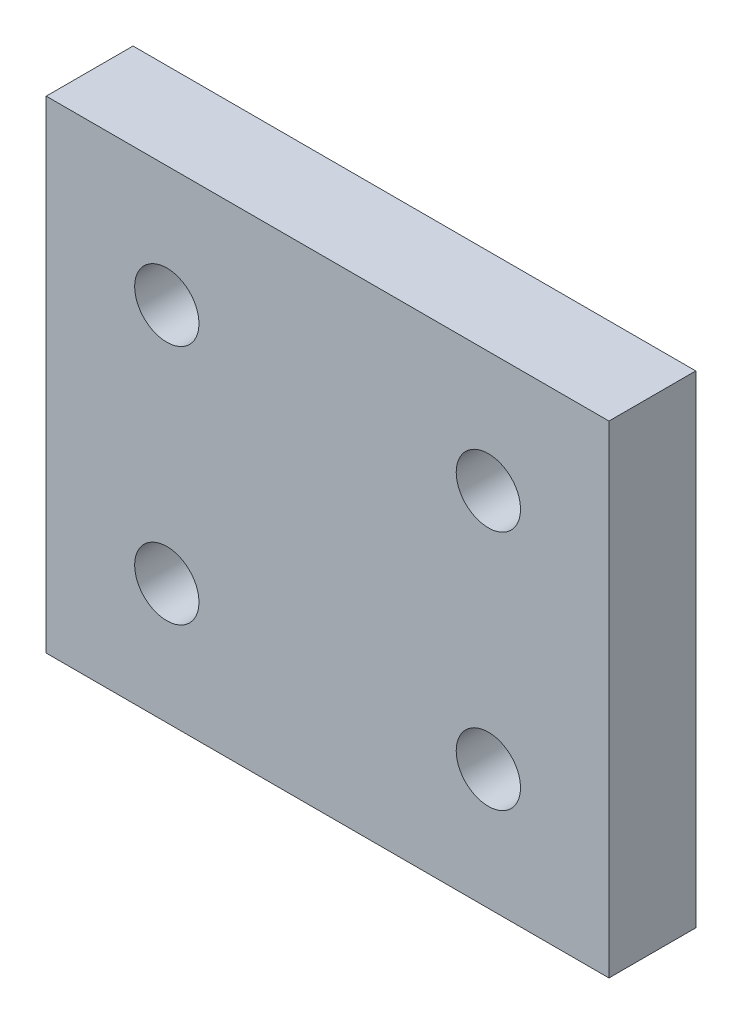
from build123d import *

# Parameters (mm, degrees)
SKETCH1_W                      = 35
SKETCH1_H                      = 60
BOSS_EXTRUDE1_DEPTH            = 5.4
CUT_EXTRUDE1_REACH             = 37.148
SKETCH2_W                      = 35
SKETCH2_H                      = 2.655
SKETCH2_R                      = 2
SKETCH2_H_2                    = 17.637243623
SKETCH2_H_3                    = 9.707756377
CUT_EXTRUDE1_DIRECTION_2_DEPTH = 36.148399679


with BuildPart() as part:
    # Sketch1 → Boss-Extrude1 (new body)
    with BuildSketch(Plane.XY):
        Rectangle(SKETCH1_W, SKETCH1_H)
    extrude(amount=BOSS_EXTRUDE1_DEPTH)

    # Sketch2 → Cut-Extrude1 (cut, up to next)
    with BuildSketch(Plane.XY.offset(5.4), mode=Mode.PRIVATE) as cut_extrude1_sk1:
        with Locations((0, 28.6725)):
            Rectangle(SKETCH2_W, SKETCH2_H)
    cut_extrude1_tool1 = extrude(cut_extrude1_sk1.sketch, amount=-CUT_EXTRUDE1_REACH, mode=Mode.PRIVATE) & part.part
    # Sketch2 → Cut-Extrude1 (cut, up to next)
    with BuildSketch(Plane.XY.offset(5.4), mode=Mode.PRIVATE) as cut_extrude1_sk2:
        with Locations(Location((-10, 19.84, 0), (0, 0, 180))):
            Circle(SKETCH2_R)
    cut_extrude1_tool2 = extrude(cut_extrude1_sk2.sketch, amount=-CUT_EXTRUDE1_REACH, mode=Mode.PRIVATE) & part.part
    # Sketch2 → Cut-Extrude1 (cut, up to next)
    with BuildSketch(Plane.XY.offset(5.4), mode=Mode.PRIVATE) as cut_extrude1_sk3:
        with Locations(Location((10, 19.84, 0), (0, 0, 180))):
            Circle(SKETCH2_R)
    cut_extrude1_tool3 = extrude(cut_extrude1_sk3.sketch, amount=-CUT_EXTRUDE1_REACH, mode=Mode.PRIVATE) & part.part
    # Sketch2 → Cut-Extrude1 (cut, up to next)
    with BuildSketch(Plane.XY.offset(5.4), mode=Mode.PRIVATE) as cut_extrude1_sk4:
        with Locations(Location((-10, 4.84, 0), (0, 0, 180))):
            Circle(SKETCH2_R)
    cut_extrude1_tool4 = extrude(cut_extrude1_sk4.sketch, amount=-CUT_EXTRUDE1_REACH, mode=Mode.PRIVATE) & part.part
    # Sketch2 → Cut-Extrude1 (cut, up to next)
    with BuildSketch(Plane.XY.offset(5.4), mode=Mode.PRIVATE) as cut_extrude1_sk5:
        with Locations(Location((10, 4.84, 0), (0, 0, 180))):
            Circle(SKETCH2_R)
    cut_extrude1_tool5 = extrude(cut_extrude1_sk5.sketch, amount=-CUT_EXTRUDE1_REACH, mode=Mode.PRIVATE) & part.part
    # Sketch2 → Cut-Extrude1 (cut, up to next)
    with BuildSketch(Plane.XY.offset(5.4), mode=Mode.PRIVATE) as cut_extrude1_sk6:
        with Locations((0, -11.473621812)):
            Rectangle(SKETCH2_W, SKETCH2_H_2)
    cut_extrude1_tool6 = extrude(cut_extrude1_sk6.sketch, amount=-CUT_EXTRUDE1_REACH, mode=Mode.PRIVATE) & part.part
    # Sketch2 → Cut-Extrude1 (cut, up to next)
    with BuildSketch(Plane.XY.offset(5.4), mode=Mode.PRIVATE) as cut_extrude1_sk7:
        with Locations((0, -25.146121812)):
            Rectangle(SKETCH2_W, SKETCH2_H_3)
    cut_extrude1_tool7 = extrude(cut_extrude1_sk7.sketch, amount=-CUT_EXTRUDE1_REACH, mode=Mode.PRIVATE) & part.part
    add(cut_extrude1_tool1.solids().sort_by_distance((0, 28.6725, 5.4))[0], mode=Mode.SUBTRACT)
    add(cut_extrude1_tool2.solids().sort_by_distance((-10, 19.84, 5.4))[0], mode=Mode.SUBTRACT)
    add(cut_extrude1_tool3.solids().sort_by_distance((10, 19.84, 5.4))[0], mode=Mode.SUBTRACT)
    add(cut_extrude1_tool4.solids().sort_by_distance((-10, 4.84, 5.4))[0], mode=Mode.SUBTRACT)
    add(cut_extrude1_tool5.solids().sort_by_distance((10, 4.84, 5.4))[0], mode=Mode.SUBTRACT)
    add(cut_extrude1_tool6.solids().sort_by_distance((0, -11.473622, 5.4))[0], mode=Mode.SUBTRACT)
    add(cut_extrude1_tool7.solids().sort_by_distance((0, -25.146122, 5.4))[0], mode=Mode.SUBTRACT)

    # Sketch2 → Cut-Extrude1 direction 2 (cut)
    with BuildSketch(Plane.XY.offset(5.4)):
        with Locations((0, 28.6725)):
            Rectangle(SKETCH2_W, SKETCH2_H)
        with Locations(Location((-10, 19.84, 0), (0, 0, 180))):
            Circle(SKETCH2_R)
        with Locations(Location((10, 19.84, 0), (0, 0, 180))):
            Circle(SKETCH2_R)
        with Locations(Location((-10, 4.84, 0), (0, 0, 180))):
            Circle(SKETCH2_R)
        with Locations(Location((10, 4.84, 0), (0, 0, 180))):
            Circle(SKETCH2_R)
        with Locations((0, -11.473621812)):
            Rectangle(SKETCH2_W, SKETCH2_H_2)
        with Locations((0, -25.146121812)):
            Rectangle(SKETCH2_W, SKETCH2_H_3)
    extrude(amount=CUT_EXTRUDE1_DIRECTION_2_DEPTH, mode=Mode.SUBTRACT)


solid = part.part
